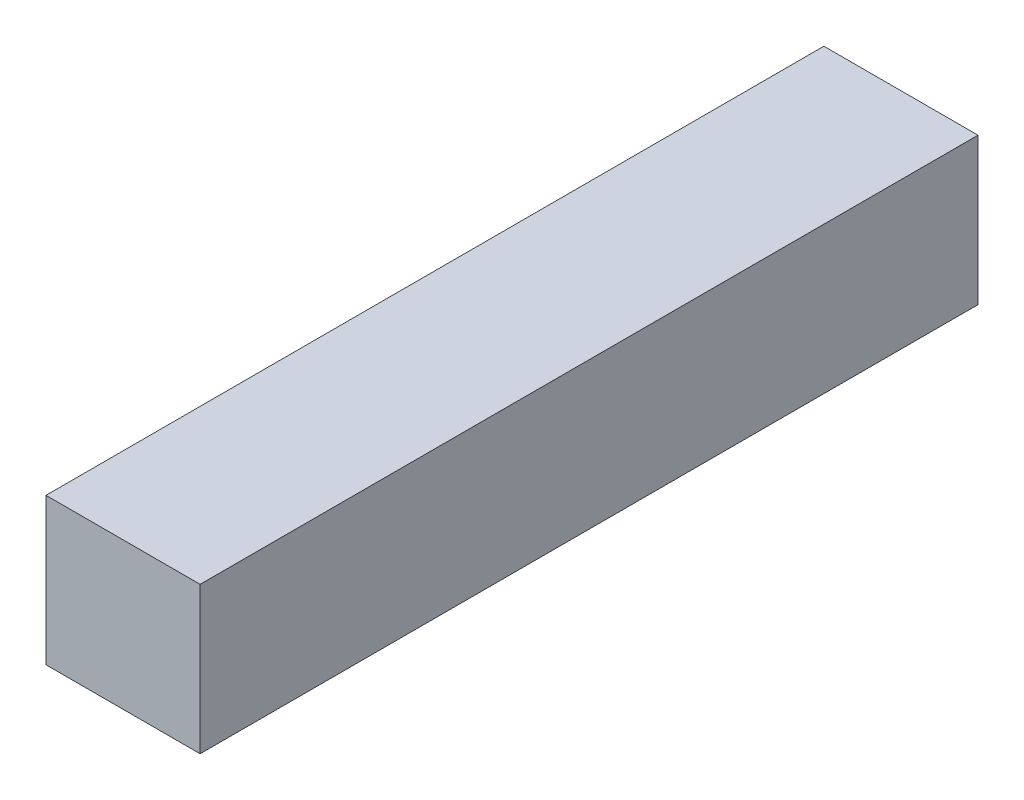
from build123d import *

# Parameters (mm, degrees)
ESQUISSE1_W        = 63
ESQUISSE1_H        = 60
BOSS_EXTRU_1_DEPTH = 318


with BuildPart() as part:
    # Esquisse1 → Boss.-Extru.1 (new body)
    with BuildSketch(Plane.XY):
        with Locations((-31.5, 30)):
            Rectangle(ESQUISSE1_W, ESQUISSE1_H)
    extrude(amount=BOSS_EXTRU_1_DEPTH)


solid = part.part
